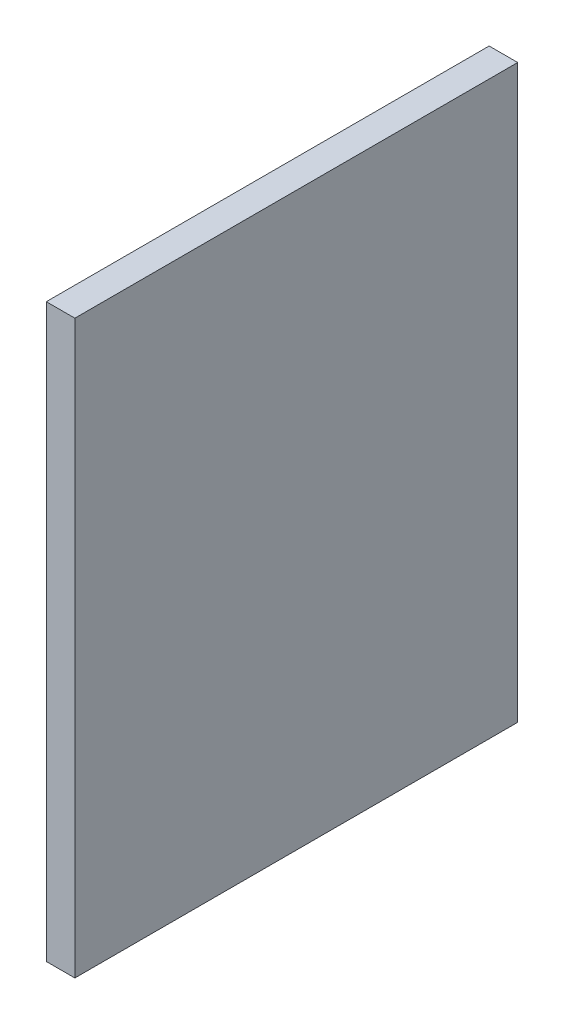
from build123d import *

# Parameters (mm, degrees)
SKCAJASUJETADORAOESTE_W   = 20
SKCAJASUJETADORAOESTE_H   = 310
CAJASUJETADORAOESTE_DEPTH = 400


with BuildPart() as part:
    # SkCajaSujetadoraOeste → CajaSujetadoraOeste (new body)
    with BuildSketch(Plane(origin=(0, 630, 0), x_dir=(1, 0, 0), z_dir=(0, 1, 0))):
        with Locations((-145, 0)):
            Rectangle(SKCAJASUJETADORAOESTE_W, SKCAJASUJETADORAOESTE_H)
    extrude(amount=CAJASUJETADORAOESTE_DEPTH)


solid = part.part
